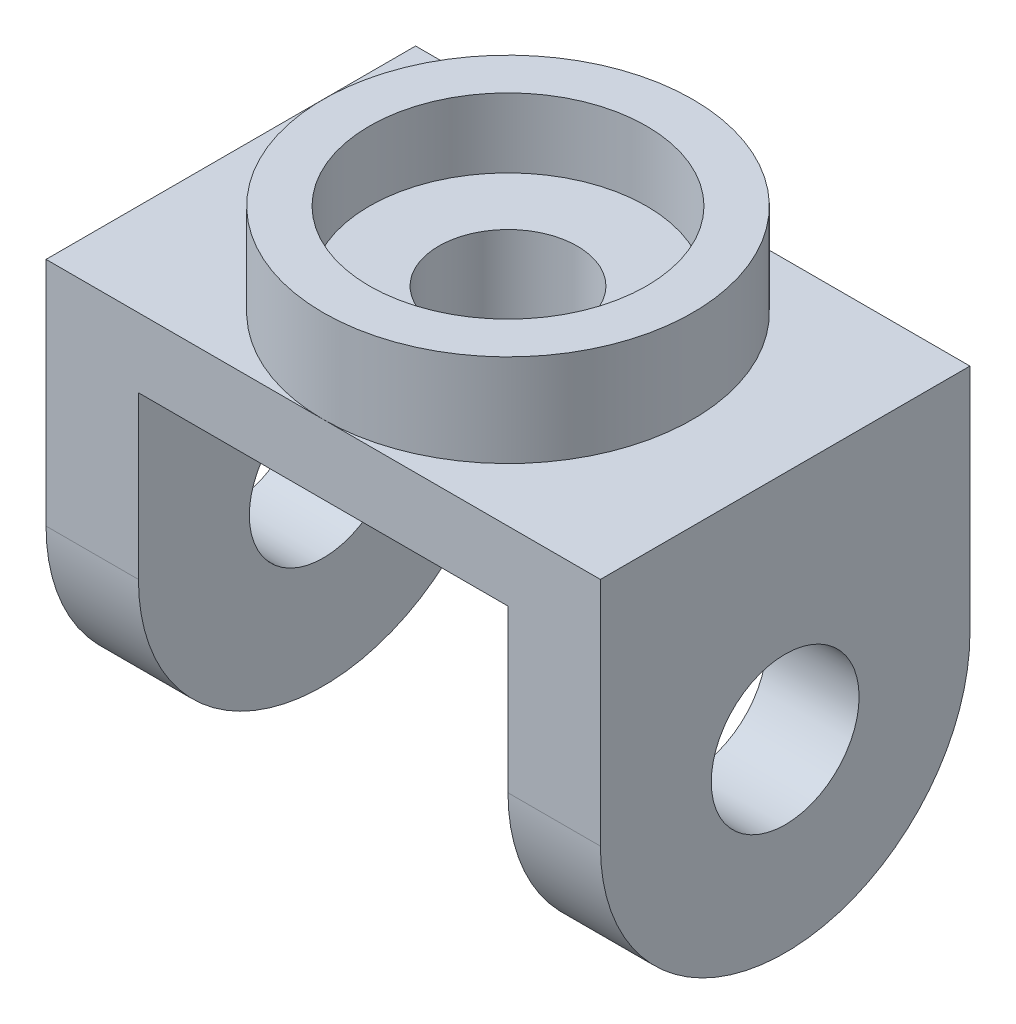
from build123d import *

# Parameters (mm, degrees)
SKETCH1_W           = 120
SKETCH1_H           = 80
BOSS_EXTRUDE1_DEPTH = 15
SKETCH2_R           = 40
SKETCH2_R_2         = 30
BOSS_EXTRUDE2_DEPTH = 20
SKETCH3_R           = 30
BOSS_EXTRUDE3_DEPTH = 5
SKETCH4_R           = 15
CUT_EXTRUDE1_DEPTH  = 75.833147735
BOSS_EXTRUDE6_DEPTH = 20
CUT_EXTRUDE2_REACH  = 149.054
SKETCH7_R           = 16
CUT_EXTRUDE3_REACH  = 117.326
SKETCH8_R           = 15


with BuildPart() as part:
    # Sketch1 → Boss-Extrude1 (new body)
    with BuildSketch(Plane(origin=(0, 0, 0), x_dir=(1, 0, 0), z_dir=(0, 1, 0))):
        Rectangle(SKETCH1_W, SKETCH1_H)
    boss_extrude1 = extrude(amount=BOSS_EXTRUDE1_DEPTH)

    # Sketch2 → Boss-Extrude2 (add)
    with BuildSketch(Plane(origin=(0, 15, 0), x_dir=(1, 0, 0), z_dir=(0, 1, 0))):
        with Locations(Location((0, 0, 0), (0, 0, 270))):
            Circle(SKETCH2_R)
        with Locations(Location((0, 0, 0), (0, 0, 270))):
            Circle(SKETCH2_R_2, mode=Mode.SUBTRACT)
    extrude(amount=BOSS_EXTRUDE2_DEPTH)

    # Sketch3 → Boss-Extrude3 (add)
    with BuildSketch(Plane(origin=(0, 15, 0), x_dir=(1, 0, 0), z_dir=(0, 1, 0))):
        with Locations(Location((0, 0, 0), (0, 0, 270))):
            Circle(SKETCH3_R)
    extrude(amount=BOSS_EXTRUDE3_DEPTH)

    # Sketch4 → Cut-Extrude1 (cut, through all)
    with BuildSketch(Plane(origin=(0, 20, 0), x_dir=(1, 0, 0), z_dir=(0, 1, 0))):
        with Locations(Location((0, 0, 0), (0, 0, 270))):
            Circle(SKETCH4_R)
    extrude(amount=-CUT_EXTRUDE1_DEPTH, mode=Mode.SUBTRACT)

    # Sketch6 → Boss-Extrude6 (add)
    with BuildSketch(Plane.ZY.offset(60)):
        with BuildLine():
            Line((-40, 15), (40, 15))
            Line((40, 15), (40, -35))
            ThreePointArc((40, -35), (0, -75), (-40, -35))
            Line((-40, -35), (-40, 15))
        make_face()
    boss_extrude6 = extrude(amount=-BOSS_EXTRUDE6_DEPTH)

    # Sketch7 → Cut-Extrude2 (cut, up to next)
    with BuildSketch(Plane.ZY.offset(60), mode=Mode.PRIVATE) as cut_extrude2_sk1:
        with Locations((0, -35)):
            Circle(SKETCH7_R)
    cut_extrude2_tool1 = extrude(cut_extrude2_sk1.sketch, amount=-CUT_EXTRUDE2_REACH, mode=Mode.PRIVATE) & part.part
    cut_extrude2 = cut_extrude2_tool1.solids().sort_by_distance((-60, -35, 0))[0]
    add(cut_extrude2, mode=Mode.SUBTRACT)

    # Mirror2: Boss-Extrude1, Boss-Extrude6, Cut-Extrude2 across plane
    add(boss_extrude1.mirror(Plane(origin=(0, 0, 0), x_dir=(0, 0, 1), z_dir=(1, 0, 0))))
    add(boss_extrude6.mirror(Plane(origin=(0, 0, 0), x_dir=(0, 0, 1), z_dir=(1, 0, 0))))
    add(cut_extrude2.mirror(Plane(origin=(0, 0, 0), x_dir=(0, 0, 1), z_dir=(1, 0, 0))), mode=Mode.SUBTRACT)

    # Sketch8 → Cut-Extrude3 (cut, up to next)
    with BuildSketch(Plane(origin=(0, 15, 0), x_dir=(1, 0, 0), z_dir=(0, 1, 0)), mode=Mode.PRIVATE) as cut_extrude3_sk1:
        with Locations(Location((0, 0, 0), (0, 0, 270))):
            Circle(SKETCH8_R)
    cut_extrude3_tool1 = extrude(cut_extrude3_sk1.sketch, amount=-CUT_EXTRUDE3_REACH, mode=Mode.PRIVATE) & part.part
    add(cut_extrude3_tool1.solids().sort_by_distance((0, 15, 0))[0], mode=Mode.SUBTRACT)


solid = part.part
